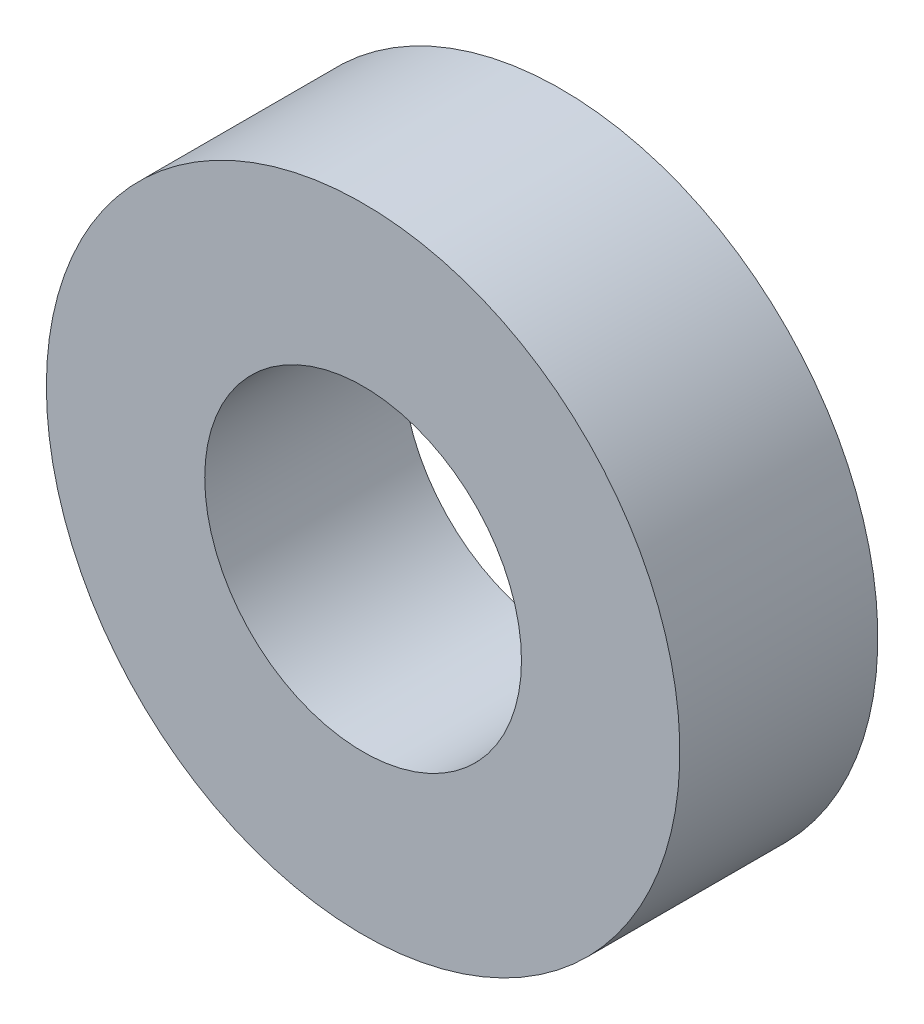
from build123d import *

# Parameters (mm, degrees)
SKETCH1_R           = 5.08
SKETCH1_R_2         = 2.54
BOSS_EXTRUDE1_DEPTH = 3.175


with BuildPart() as part:
    # Sketch1 → Boss-Extrude1 (new body)
    with BuildSketch(Plane.XY):
        with Locations(Location((0, 0, 0), (0, 0, 180))):
            Circle(SKETCH1_R)
        with Locations(Location((0, 0, 0), (0, 0, 180))):
            Circle(SKETCH1_R_2, mode=Mode.SUBTRACT)
    extrude(amount=BOSS_EXTRUDE1_DEPTH)


solid = part.part
